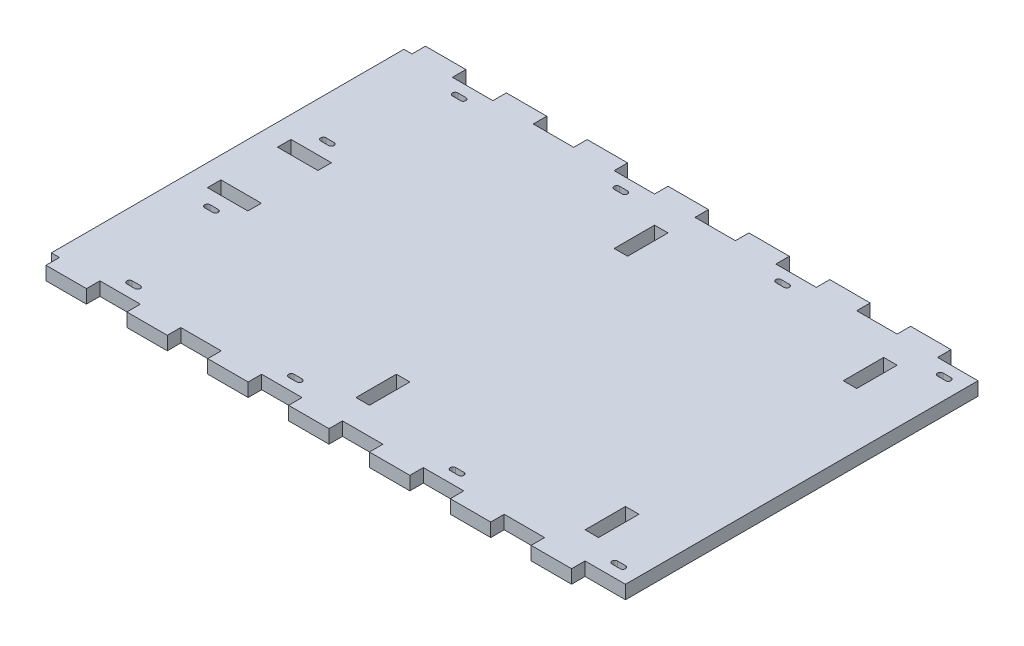
from build123d import *

# Parameters (mm, degrees)
SKETCH1_W                 = 213
SKETCH1_H                 = 140.79
BOSS_EXTRUDE1_DEPTH       = 5
SKETCH2_W                 = 15
SKETCH2_H                 = 5
CUT_EXTRUDE1_DEPTH        = 128.760346059
CUT_EXTRUDE3_DEPTH        = 128.760346059
LPATTERN2_COUNT           = 4
LPATTERN2_PITCH           = 60
LPATTERN1_COUNT           = 7
LPATTERN1_PITCH           = 30
LPATTERN1_COPY_1_SKETCH_W = 15
LPATTERN1_COPY_1_SKETCH_H = 5
LPATTERN1_COPY_1_DEPTH    = 128.760346059
LPATTERN1_COPY_2_SKETCH_W = 15
LPATTERN1_COPY_2_SKETCH_H = 5
LPATTERN1_COPY_2_DEPTH    = 128.760346059
LPATTERN1_COPY_3_SKETCH_W = 15
LPATTERN1_COPY_3_SKETCH_H = 5
LPATTERN1_COPY_3_DEPTH    = 128.760346059
LPATTERN1_COPY_4_SKETCH_W = 15
LPATTERN1_COPY_4_SKETCH_H = 5
LPATTERN1_COPY_4_DEPTH    = 128.760346059
LPATTERN1_COPY_5_SKETCH_W = 15
LPATTERN1_COPY_5_SKETCH_H = 5
LPATTERN1_COPY_5_DEPTH    = 128.760346059
LPATTERN1_COPY_6_SKETCH_W = 15
LPATTERN1_COPY_6_SKETCH_H = 5
LPATTERN1_COPY_6_DEPTH    = 128.760346059
SKETCH3_W                 = 5
SKETCH3_H                 = 15
SKETCH3_W_2               = 15
SKETCH3_H_2               = 5
CUT_EXTRUDE2_DEPTH        = 128.760346059
MIRROR2_COPY_1_DEPTH      = 128.760346059
MIRROR2_COPY_2_DEPTH      = 128.760346059
MIRROR2_COPY_3_DEPTH      = 128.760346059
CUT_EXTRUDE4_DEPTH        = 128.760346059
SKETCH7_W                 = 3
SKETCH7_H                 = 5
CUT_EXTRUDE5_DEPTH        = 128.760346059


with BuildPart() as part:
    # Sketch1 → Boss-Extrude1 (new body)
    with BuildSketch(Plane(origin=(0, 0, 0), x_dir=(1, 0, 0), z_dir=(0, 1, 0))):
        Rectangle(SKETCH1_W, SKETCH1_H)
    extrude(amount=BOSS_EXTRUDE1_DEPTH)

    # Sketch2 → Cut-Extrude1 (cut, through all)
    with BuildSketch(Plane.XZ):
        with Locations((99, 67.895)):
            Rectangle(SKETCH2_W, SKETCH2_H)
    cut_extrude1 = extrude(amount=-CUT_EXTRUDE1_DEPTH, mode=Mode.SUBTRACT)

    # Sketch5 → Cut-Extrude3 (cut, through all)
    with BuildSketch(Plane.XZ):
        with BuildLine():
            Line((100.5, 59.395), (97.5, 59.395))
            ThreePointArc((97.5, 59.395), (96.5, 60.395), (97.5, 61.395))
            Line((97.5, 61.395), (100.5, 61.395))
            ThreePointArc((100.5, 61.395), (101.5, 60.395), (100.5, 59.395))
        make_face()
    cut_extrude3 = extrude(amount=-CUT_EXTRUDE3_DEPTH, mode=Mode.SUBTRACT)

    # LPattern2: Cut-Extrude3 ×4
    with Locations(*[(-i * LPATTERN2_PITCH, 0, 0) for i in range(1, LPATTERN2_COUNT)]):
        add(cut_extrude3, mode=Mode.SUBTRACT)

    # Mirror1: Cut-Extrude1 across plane
    add(cut_extrude1.mirror(Plane.XY), mode=Mode.SUBTRACT)

    # LPattern1: Cut-Extrude1 ×7
    with Locations(*[(-i * LPATTERN1_PITCH, 0, 0) for i in range(1, LPATTERN1_COUNT)]):
        add(cut_extrude1, mode=Mode.SUBTRACT)

    # LPattern1 copy 1 sketch → LPattern1 copy 1 (cut, through all)
    with BuildSketch(Plane(origin=(-30, 0, 0), x_dir=(1, 0, 0), z_dir=(0, -1, 0))):
        with Locations((99, -67.895)):
            Rectangle(LPATTERN1_COPY_1_SKETCH_W, LPATTERN1_COPY_1_SKETCH_H)
    extrude(amount=-LPATTERN1_COPY_1_DEPTH, mode=Mode.SUBTRACT)

    # LPattern1 copy 2 sketch → LPattern1 copy 2 (cut, through all)
    with BuildSketch(Plane(origin=(-60, 0, 0), x_dir=(1, 0, 0), z_dir=(0, -1, 0))):
        with Locations((99, -67.895)):
            Rectangle(LPATTERN1_COPY_2_SKETCH_W, LPATTERN1_COPY_2_SKETCH_H)
    extrude(amount=-LPATTERN1_COPY_2_DEPTH, mode=Mode.SUBTRACT)

    # LPattern1 copy 3 sketch → LPattern1 copy 3 (cut, through all)
    with BuildSketch(Plane(origin=(-90, 0, 0), x_dir=(1, 0, 0), z_dir=(0, -1, 0))):
        with Locations((99, -67.895)):
            Rectangle(LPATTERN1_COPY_3_SKETCH_W, LPATTERN1_COPY_3_SKETCH_H)
    extrude(amount=-LPATTERN1_COPY_3_DEPTH, mode=Mode.SUBTRACT)

    # LPattern1 copy 4 sketch → LPattern1 copy 4 (cut, through all)
    with BuildSketch(Plane(origin=(-120, 0, 0), x_dir=(1, 0, 0), z_dir=(0, -1, 0))):
        with Locations((99, -67.895)):
            Rectangle(LPATTERN1_COPY_4_SKETCH_W, LPATTERN1_COPY_4_SKETCH_H)
    extrude(amount=-LPATTERN1_COPY_4_DEPTH, mode=Mode.SUBTRACT)

    # LPattern1 copy 5 sketch → LPattern1 copy 5 (cut, through all)
    with BuildSketch(Plane(origin=(-150, 0, 0), x_dir=(1, 0, 0), z_dir=(0, -1, 0))):
        with Locations((99, -67.895)):
            Rectangle(LPATTERN1_COPY_5_SKETCH_W, LPATTERN1_COPY_5_SKETCH_H)
    extrude(amount=-LPATTERN1_COPY_5_DEPTH, mode=Mode.SUBTRACT)

    # LPattern1 copy 6 sketch → LPattern1 copy 6 (cut, through all)
    with BuildSketch(Plane(origin=(-180, 0, 0), x_dir=(1, 0, 0), z_dir=(0, -1, 0))):
        with Locations((99, -67.895)):
            Rectangle(LPATTERN1_COPY_6_SKETCH_W, LPATTERN1_COPY_6_SKETCH_H)
    extrude(amount=-LPATTERN1_COPY_6_DEPTH, mode=Mode.SUBTRACT)

    # Sketch3 → Cut-Extrude2 (cut, through all)
    with BuildSketch(Plane.XZ):
        with Locations((-1, 47.895)):
            Rectangle(SKETCH3_W, SKETCH3_H)
        with Locations((-1, -47.895)):
            Rectangle(SKETCH3_W, SKETCH3_H)
        with Locations((84, -47.895)):
            Rectangle(SKETCH3_W, SKETCH3_H)
        with Locations((84, 47.895)):
            Rectangle(SKETCH3_W, SKETCH3_H)
        with Locations((-91, 13)):
            Rectangle(SKETCH3_W_2, SKETCH3_H_2)
        with Locations((-91, -13)):
            Rectangle(SKETCH3_W_2, SKETCH3_H_2)
    extrude(amount=-CUT_EXTRUDE2_DEPTH, mode=Mode.SUBTRACT)

    # Mirror2: Cut-Extrude3 across plane
    add(cut_extrude3.mirror(Plane.XY), mode=Mode.SUBTRACT)

    # Mirror2 copy 1 sketch → Mirror2 copy 1 (cut, through all)
    with BuildSketch(Plane(origin=(-60, 0, 0), x_dir=(1, 0, 0), z_dir=(0, -1, 0))):
        with BuildLine():
            Line((100.5, -59.395), (97.5, -59.395))
            ThreePointArc((97.5, -59.395), (96.5, -60.395), (97.5, -61.395))
            Line((97.5, -61.395), (100.5, -61.395))
            ThreePointArc((100.5, -61.395), (101.5, -60.395), (100.5, -59.395))
        make_face()
    extrude(amount=-MIRROR2_COPY_1_DEPTH, mode=Mode.SUBTRACT)

    # Mirror2 copy 2 sketch → Mirror2 copy 2 (cut, through all)
    with BuildSketch(Plane(origin=(-120, 0, 0), x_dir=(1, 0, 0), z_dir=(0, -1, 0))):
        with BuildLine():
            Line((100.5, -59.395), (97.5, -59.395))
            ThreePointArc((97.5, -59.395), (96.5, -60.395), (97.5, -61.395))
            Line((97.5, -61.395), (100.5, -61.395))
            ThreePointArc((100.5, -61.395), (101.5, -60.395), (100.5, -59.395))
        make_face()
    extrude(amount=-MIRROR2_COPY_2_DEPTH, mode=Mode.SUBTRACT)

    # Mirror2 copy 3 sketch → Mirror2 copy 3 (cut, through all)
    with BuildSketch(Plane(origin=(-180, 0, 0), x_dir=(1, 0, 0), z_dir=(0, -1, 0))):
        with BuildLine():
            Line((100.5, -59.395), (97.5, -59.395))
            ThreePointArc((97.5, -59.395), (96.5, -60.395), (97.5, -61.395))
            Line((97.5, -61.395), (100.5, -61.395))
            ThreePointArc((100.5, -61.395), (101.5, -60.395), (100.5, -59.395))
        make_face()
    extrude(amount=-MIRROR2_COPY_3_DEPTH, mode=Mode.SUBTRACT)

    # Sketch6 → Cut-Extrude4 (cut, through all)
    with BuildSketch(Plane.XZ):
        with BuildLine():
            Line((-92.5, 22.5), (-89.5, 22.5))
            ThreePointArc((-89.5, 22.5), (-88.5, 21.5), (-89.5, 20.5))
            Line((-89.5, 20.5), (-92.5, 20.5))
            ThreePointArc((-92.5, 20.5), (-93.5, 21.5), (-92.5, 22.5))
        make_face()
        with BuildLine():
            Line((-92.5, -22.5), (-89.5, -22.5))
            ThreePointArc((-89.5, -22.5), (-88.5, -21.5), (-89.5, -20.5))
            Line((-89.5, -20.5), (-92.5, -20.5))
            ThreePointArc((-92.5, -20.5), (-93.5, -21.5), (-92.5, -22.5))
        make_face()
    extrude(amount=-CUT_EXTRUDE4_DEPTH, mode=Mode.SUBTRACT)

    # Sketch7 → Cut-Extrude5 (cut, through all)
    with BuildSketch(Plane.XZ):
        with Locations((-105, 67.895)):
            Rectangle(SKETCH7_W, SKETCH7_H)
        with Locations((-105, -67.895)):
            Rectangle(SKETCH7_W, SKETCH7_H)
    extrude(amount=-CUT_EXTRUDE5_DEPTH, mode=Mode.SUBTRACT)


solid = part.part
